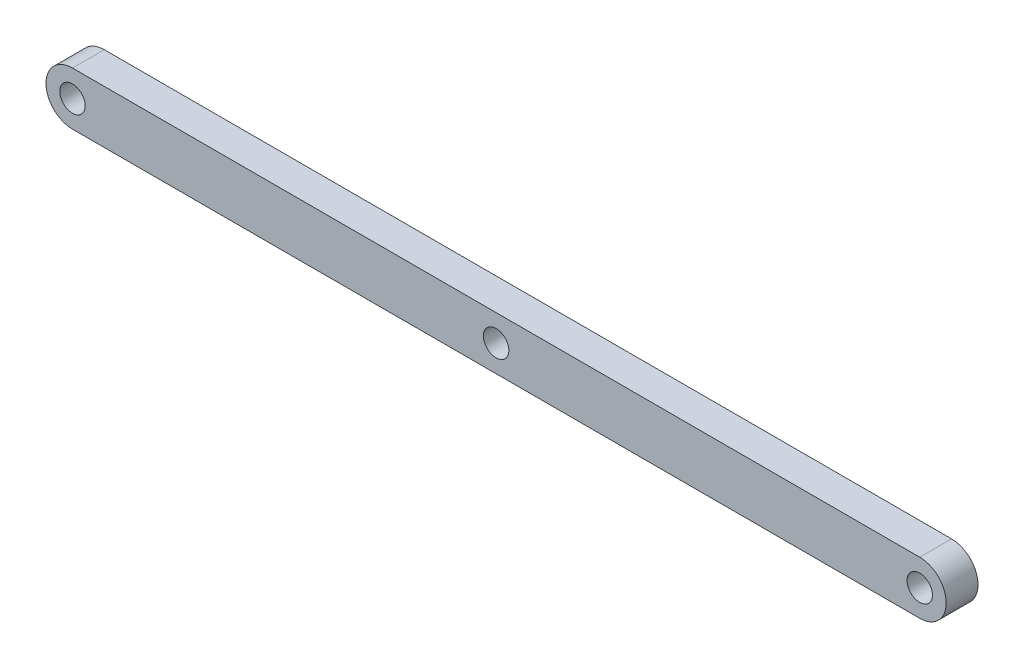
from build123d import *

# Parameters (mm, degrees)
BOSS_EXTRUDE2_DEPTH   = 30
F_3_0MM_DOWEL_HOLE1_D = 24


with BuildPart() as part:
    # Sketch1 → Boss-Extrude2 (new body)
    with BuildSketch(Plane.XY):
        with BuildLine():
            Line((0, 25), (800, 25))
            ThreePointArc((800, 25), (825, 0), (800, -25))
            Line((800, -25), (0, -25))
            ThreePointArc((0, -25), (-25, 0), (0, 25))
        make_face()
    extrude(amount=BOSS_EXTRUDE2_DEPTH)

    # Ø3.0mm Dowel Hole1 (through all)
    with Locations(Plane.XY.offset(30)):
        with Locations((0, 0), (800, 0), (400, 0)):
            Hole(F_3_0MM_DOWEL_HOLE1_D / 2)


solid = part.part
